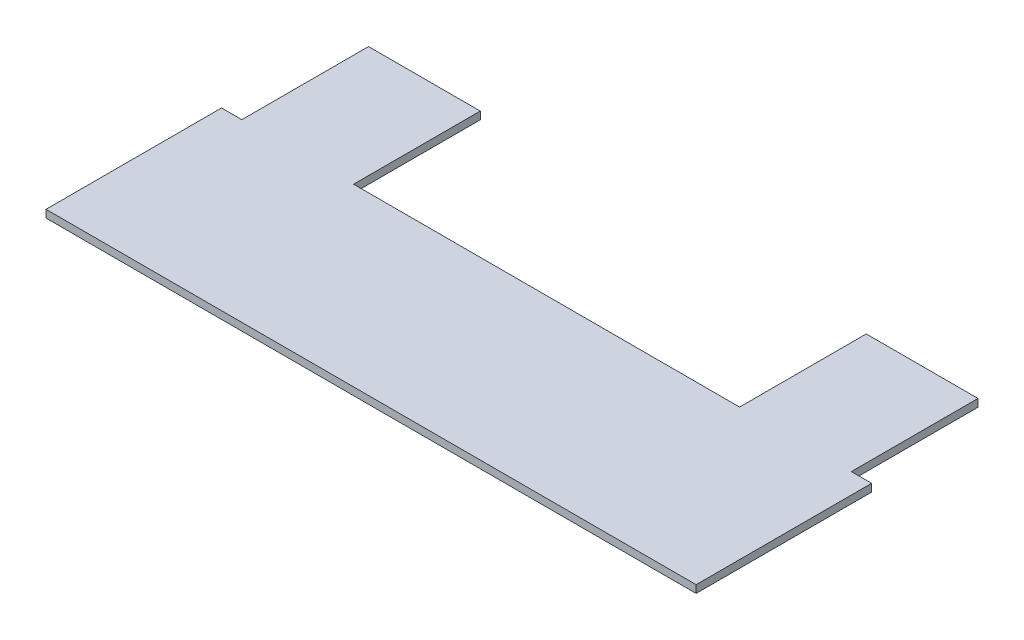
from build123d import *

# Parameters (mm, degrees)
SKETCH1_W           = 406.4
SKETCH1_H           = 188.9125
BOSS_EXTRUDE1_DEPTH = 4.7625
SKETCH2_W           = 12.7
SKETCH2_H           = 79.18196
SKETCH2_W_2         = 241.3
CUT_EXTRUDE1_DEPTH  = 4.7625


with BuildPart() as part:
    # Sketch1 → Boss-Extrude1 (new body)
    with BuildSketch(Plane(origin=(0, 0, 0), x_dir=(1, 0, 0), z_dir=(0, 1, 0))):
        Rectangle(SKETCH1_W, SKETCH1_H)
    extrude(amount=BOSS_EXTRUDE1_DEPTH)

    # Sketch2 → Cut-Extrude1 (cut)
    with BuildSketch(Plane(origin=(0, 4.7625, 0), x_dir=(1, 0, 0), z_dir=(0, 1, 0))):
        with Locations((-196.85, 54.86527)):
            Rectangle(SKETCH2_W, SKETCH2_H)
        with Locations((196.85, 54.86527)):
            Rectangle(SKETCH2_W, SKETCH2_H)
        with Locations((0, 54.86527)):
            Rectangle(SKETCH2_W_2, SKETCH2_H)
    extrude(amount=-CUT_EXTRUDE1_DEPTH, mode=Mode.SUBTRACT)


solid = part.part
